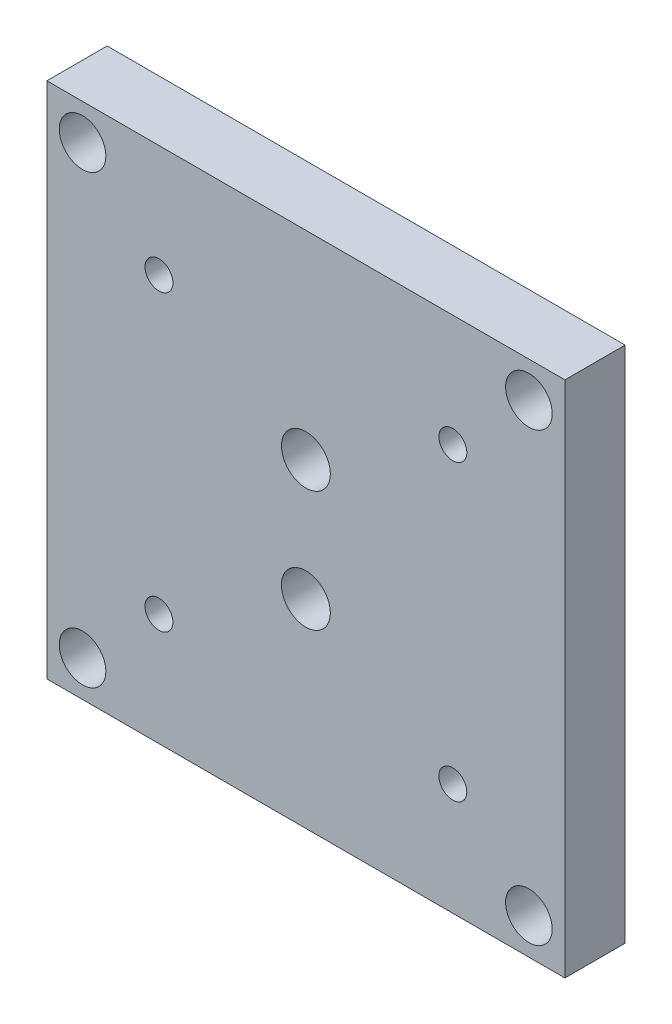
from build123d import *

# Parameters (mm, degrees)
SKETCH1_W                    = 54.61
SKETCH1_H                    = 54.61
BOSS_EXTRUDE1_DEPTH          = 6.35
F_10_0_1935_DIAMETER_HOLE1_D = 4.9149
F_32_0_116_DIAMETER_HOLE1_D  = 2.9464
SKETCH10_R                   = 2.5781
CUT_EXTRUDE1_DEPTH           = 6.35


with BuildPart() as part:
    # Sketch1 → Boss-Extrude1 (new body)
    with BuildSketch(Plane.XY):
        Rectangle(SKETCH1_W, SKETCH1_H)
    extrude(amount=BOSS_EXTRUDE1_DEPTH)

    # #10 (0.1935) Diameter Hole1 (through all)
    with Locations(Plane.XY.offset(6.35)):
        with Locations((-23.5458, 23.5458), (23.510742074, 23.5458), (23.510742074, -23.510742074), (-23.5458, -23.510742074)):
            Hole(F_10_0_1935_DIAMETER_HOLE1_D / 2)

    # #32 (0.116) Diameter Hole1 (through all)
    with Locations(Plane.XY.offset(6.35)):
        with Locations((-15.487883014, 15.494), (15.494, 15.487883014), (15.487883014, -15.494), (-15.494, -15.487883014)):
            Hole(F_32_0_116_DIAMETER_HOLE1_D / 2)

    # Sketch10 → Cut-Extrude1 (cut)
    with BuildSketch(Plane.XY):
        with Locations((0, 6.35)):
            Circle(SKETCH10_R)
        with Locations((0, -6.35)):
            Circle(SKETCH10_R)
    extrude(amount=CUT_EXTRUDE1_DEPTH, mode=Mode.SUBTRACT)


solid = part.part
